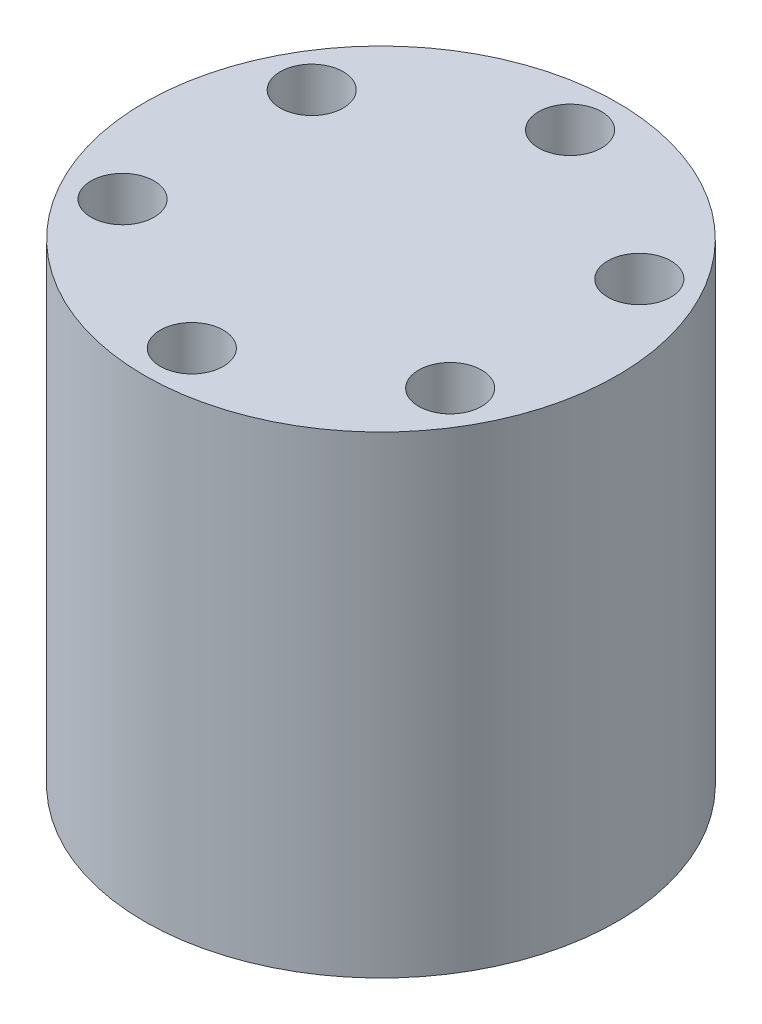
from build123d import *

# Parameters (mm, degrees)
SKETCH1_R             = 15
BOSS_EXTRUDE1_DEPTH   = 30
SKETCH2_R             = 7
BOSS_EXTRUDE2_DEPTH   = 4
F_4_0MM_DOWEL_HOLE1_D = 4
CIRPATTERN1_COUNT     = 6


with BuildPart() as part:
    # Sketch1 → Boss-Extrude1 (new body)
    with BuildSketch(Plane(origin=(0, 0, 0), x_dir=(1, 0, 0), z_dir=(0, 1, 0))):
        Circle(SKETCH1_R)
    extrude(amount=BOSS_EXTRUDE1_DEPTH)

    # Sketch2 → Boss-Extrude2 (add)
    with BuildSketch(Plane.XZ):
        Circle(SKETCH2_R)
    extrude(amount=BOSS_EXTRUDE2_DEPTH)

    # Ø4.0mm Dowel Hole1 (through all)
    with Locations(Plane(origin=(0, 0, 0), x_dir=(-1, 0, 0), z_dir=(0, -1, 0))):
        with Locations((0, -12)):
            f_4_0mm_dowel_hole1 = Hole(F_4_0MM_DOWEL_HOLE1_D / 2)

    # CirPattern1: Ø4.0mm Dowel Hole1 ×6 about axis
    cirpattern1_axis = Axis((0, 30, 0), (0, -1, 0))
    for i in range(1, CIRPATTERN1_COUNT):
        add(f_4_0mm_dowel_hole1.rotate(cirpattern1_axis, i * 360 / CIRPATTERN1_COUNT), mode=Mode.SUBTRACT)


solid = part.part
